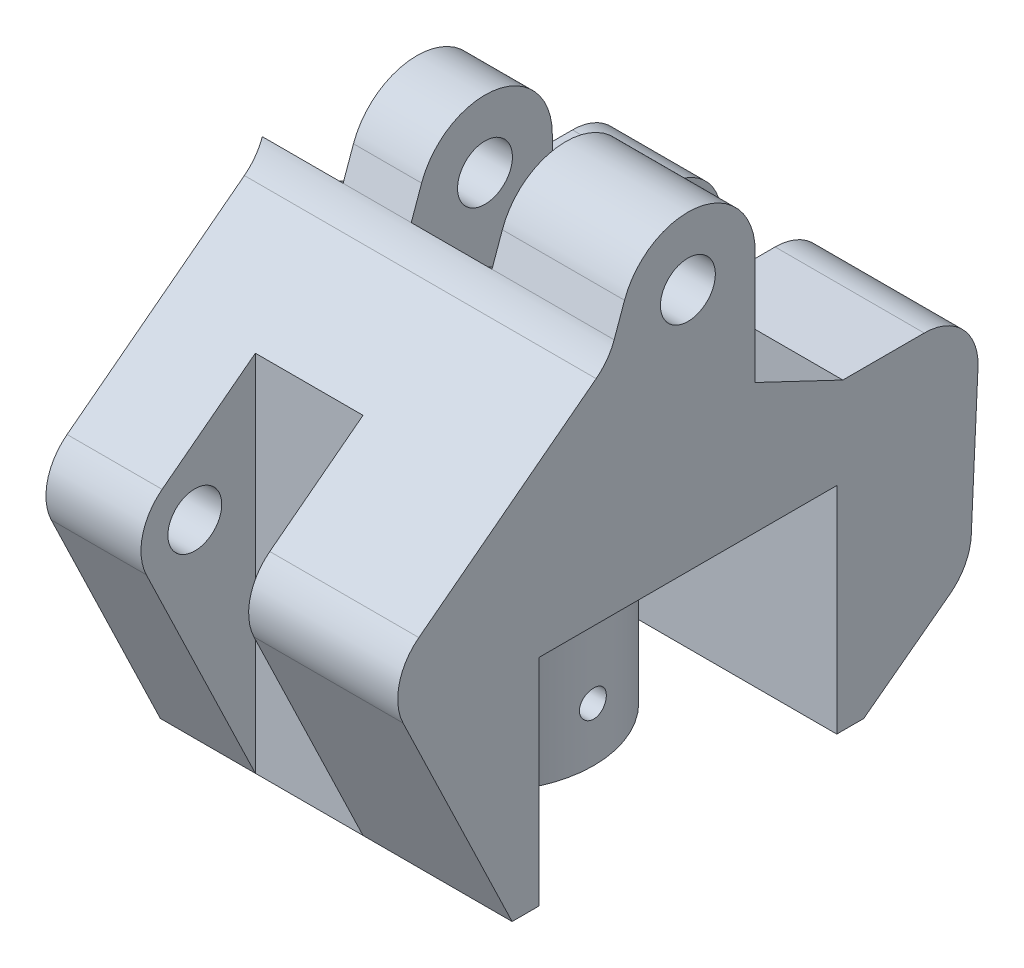
from build123d import *
from build123d.topology import SkipClean

# Parameters (mm, degrees)
SKETCH1_R                    = 3.2385
BOSS_EXTRUDE1_DEPTH          = 17.5641
CUT_EXTRUDE1_DEPTH           = 39.015523314
CUT_EXTRUDE1_DEPTH_BACK      = 39.015523314
SKETCH2_W                    = 9.525
SKETCH2_H                    = 33.5407
BOSS_EXTRUDE2_DEPTH          = 25.4
SKETCH17_R                   = 7.9375
CUT_EXTRUDE2_DEPTH           = 22.225
F_1_8_0_125_DIAMETER_HOLE1_D = 3.175
F_1_8_0_125_DIAMETER_HOLE3_D = 3.175
BOSS_EXTRUDE3_DEPTH          = 9.525
BOSS_EXTRUDE4_START          = -17.5641
BOSS_EXTRUDE4_DEPTH          = 9.525
BOSS_EXTRUDE5_REACH          = 68.916
SKETCH19_R                   = 3.175
CUT_EXTRUDE4_DEPTH           = 67.450455183
CUT_EXTRUDE4_DEPTH_BACK      = 67.450455183
SKETCH23_W                   = 12.7
SKETCH23_H                   = 13.97
SKETCH23_H_2                 = 13.49375
CUT_EXTRUDE3_DEPTH           = 74.083211618
SKETCH26_R                   = 3.2385
BOSS_EXTRUDE6_DEPTH          = 6.3754


with BuildPart() as part:
    # Sketch1 → Boss-Extrude1 (new, symmetric)
    with BuildSketch(Plane(origin=(0, 0, 0), x_dir=(0, 0, -1), z_dir=(1, 0, 0))):
        with BuildLine():
            ThreePointArc((7.475782216, 2.667693107), (0, 7.9375), (-7.475782216, 2.667693107))
            Line((-7.475782216, 2.667693107), (-17.5641, -25.6032))
            Line((-17.5641, -25.6032), (-17.5641, -28.7782))
            Line((-17.5641, -28.7782), (17.5641, -28.7782))
            Line((17.5641, -28.7782), (17.5641, -25.6032))
            Line((17.5641, -25.6032), (7.475782216, 2.667693107))
        make_face()
        Circle(SKETCH1_R, mode=Mode.SUBTRACT)
    extrude(amount=BOSS_EXTRUDE1_DEPTH, both=True)

    # Sketch2 → Cut-Extrude1 (cut, two sides: drawn at the far end of the back side and taken through both)
    with BuildSketch(Plane.XY.offset(-CUT_EXTRUDE1_DEPTH_BACK)):
        with Locations((4.7625, -8.83285)):
            Rectangle(SKETCH2_W, SKETCH2_H)
        with Locations((-12.8016, -8.83285)):
            Rectangle(SKETCH2_W, SKETCH2_H)
    extrude(amount=CUT_EXTRUDE1_DEPTH + CUT_EXTRUDE1_DEPTH_BACK, mode=Mode.SUBTRACT)

    # Sketch3 → Boss-Extrude2 (add)
    with BuildSketch(Plane.XZ.offset(28.7782)):
        with BuildLine():
            Line((0, -12.827), (-12.827, -12.827))
            Line((-12.827, -12.827), (-12.827, 12.827))
            Line((-12.827, 12.827), (0, 12.827))
            ThreePointArc((0, 12.827), (12.827, 0), (0, -12.827))
        make_face()
    extrude(amount=BOSS_EXTRUDE2_DEPTH)

    # Sketch17 → Cut-Extrude2 (cut)
    with BuildSketch(Plane.XZ.offset(54.1782)):
        with Locations(Location((0, 0, 0), (0, 0, 270))):
            Circle(SKETCH17_R)
    extrude(amount=-CUT_EXTRUDE2_DEPTH, mode=Mode.SUBTRACT)

    # 1/8 (0.125) Diameter Hole1 (through all)
    with Locations(Plane(origin=(-12.827, 0, 0), x_dir=(0, 0, -1), z_dir=(-1, 0, 0))):
        with Locations((0, 35.1282), (0, 47.8282)):
            Hole(F_1_8_0_125_DIAMETER_HOLE1_D / 2)

    # 1/8 (0.125) Diameter Hole3 (through all)
    with Locations(Plane(origin=(0, 0, -12.827), x_dir=(-1, 0, 0), z_dir=(0, 0, -1))):
        with Locations((0, -38.3032), (0, -44.6532)):
            Hole(F_1_8_0_125_DIAMETER_HOLE3_D / 2)

    # Sketch18 → Boss-Extrude3 (add)
    with BuildSketch(Plane.ZY.offset(8.0391)):
        with BuildLine():
            Line((-14.304105108, -16.467586998), (3.748678977, -7.885564818))
            ThreePointArc((3.748678977, -7.885564818), (7.171589481, -4.980264137), (8.698272775, -0.758140681))
            Line((8.698272775, -0.758140681), (17.5641, -25.6032))
            Line((17.5641, -25.6032), (-17.5641, -25.6032))
            Line((-17.5641, -25.6032), (-14.304105108, -16.467586998))
        make_face()
    extrude(amount=BOSS_EXTRUDE3_DEPTH)

    # Sketch18<2> → Boss-Extrude4 (add)
    with BuildSketch(Plane.ZY.offset(8.0391).offset(BOSS_EXTRUDE4_START)):
        with BuildLine():
            Line((-14.304105108, -16.467586998), (3.748678977, -7.885564818))
            ThreePointArc((3.748678977, -7.885564818), (7.171589481, -4.980264137), (8.698272775, -0.758140681))
            Line((8.698272775, -0.758140681), (17.5641, -25.6032))
            Line((17.5641, -25.6032), (-17.5641, -25.6032))
            Line((-17.5641, -25.6032), (-14.304105108, -16.467586998))
        make_face()
    extrude(amount=BOSS_EXTRUDE4_DEPTH)

    # Boss-Extrude5: up to this face of the body (flat: up to its plane)
    boss_extrude5_end = Plane(part.part.faces().sort_by_distance((17.5641, -14.475405556, 0))[0])
    # Sketch19 → Boss-Extrude5 (add, up to the picked face)
    with BuildSketch(Plane.ZY.offset(17.5641), mode=Mode.PRIVATE) as boss_extrude5_sk1:
        with BuildLine():
            Line((17.5641, -25.6032), (17.5641, -28.7782))
            Line((17.5641, -28.7782), (17.5641, -54.1782))
            Line((17.5641, -54.1782), (20.7391, -54.1782))
            Line((20.7391, -54.1782), (33.604040342, -27.46293277))
            ThreePointArc((33.604040342, -27.46293277), (34.058910171, -23.231780637), (31.740001069, -19.663557619))
            Line((31.740001069, -19.663557619), (10.821747478, -3.668278576))
            ThreePointArc((10.821747478, -3.668278576), (9.549308999, -2.36695441), (8.698272775, -0.758140681))
            Line((8.698272775, -0.758140681), (17.5641, -25.6032))
        make_face()
        with Locations((27.88285, -24.70785)):
            Circle(SKETCH19_R, mode=Mode.SUBTRACT)
    boss_extrude5_tool1 = split(extrude(boss_extrude5_sk1.sketch, amount=-BOSS_EXTRUDE5_REACH, mode=Mode.PRIVATE), bisect_by=boss_extrude5_end, keep=Keep.BOTH, mode=Mode.PRIVATE)
    # Sketch19 → Boss-Extrude5 (add, up to the picked face)
    with BuildSketch(Plane.ZY.offset(17.5641), mode=Mode.PRIVATE) as boss_extrude5_sk2:
        with BuildLine():
            Line((-17.5641, -54.1782), (-17.5641, -28.7782))
            Line((-17.5641, -28.7782), (-17.5641, -25.6032))
            Line((-17.5641, -25.6032), (-14.304105108, -16.467586998))
            Line((-14.304105108, -16.467586998), (-18.280383556, -18.35785))
            Line((-18.280383556, -18.35785), (-27.88285, -18.35785))
            ThreePointArc((-27.88285, -18.35785), (-32.477893649, -20.325148338), (-34.225749351, -25.008062957))
            Line((-34.225749351, -25.008062957), (-33.431999351, -41.778412957))
            ThreePointArc((-33.431999351, -41.778412957), (-32.699976255, -44.451509208), (-30.8991, -46.5582))
            Line((-30.8991, -46.5582), (-20.7391, -54.1782))
            Line((-20.7391, -54.1782), (-17.5641, -54.1782))
        make_face()
        with Locations((-27.0891, -41.4782)):
            Circle(SKETCH19_R, mode=Mode.SUBTRACT)
        with Locations((-27.88285, -24.70785)):
            Circle(SKETCH19_R, mode=Mode.SUBTRACT)
    boss_extrude5_tool2 = split(extrude(boss_extrude5_sk2.sketch, amount=-BOSS_EXTRUDE5_REACH, mode=Mode.PRIVATE), bisect_by=boss_extrude5_end, keep=Keep.BOTH, mode=Mode.PRIVATE)
    add(boss_extrude5_tool1.solids().sort_by(Axis((-17.5641, -28.142301, 22.142189), (1, 0, 0)))[0])
    add(boss_extrude5_tool2.solids().sort_by(Axis((-17.5641, -34.358051, -24.545625), (1, 0, 0)))[0])

    # Sketch23 → Cut-Extrude4 (cut, two sides: drawn at the far end of the back side and taken through both)
    with BuildSketch(Plane(origin=(0, 0, 0), x_dir=(1, 0, 0), z_dir=(0, 1, 0)).offset(-CUT_EXTRUDE4_DEPTH_BACK)):
        with Locations((0, 27.7241)):
            Rectangle(SKETCH23_W, SKETCH23_H)
        with Locations((0, -27.485975)):
            Rectangle(SKETCH23_W, SKETCH23_H_2)
    extrude(amount=CUT_EXTRUDE4_DEPTH + CUT_EXTRUDE4_DEPTH_BACK, mode=Mode.SUBTRACT)

    # Sketch22 → Cut-Extrude3 (cut, through all)
    with BuildSketch(Plane.ZY.offset(17.5641)):
        with BuildLine():
            Line((-7.9375, 0), (-7.9375, -13.440998634))
            Line((-7.9375, -13.440998634), (-14.304105108, -16.467586998))
            Line((-14.304105108, -16.467586998), (-7.475782216, 2.667693107))
            ThreePointArc((-7.475782216, 2.667693107), (-7.821218818, 1.353677383), (-7.9375, 0))
        make_face()
    extrude(amount=-CUT_EXTRUDE3_DEPTH, mode=Mode.SUBTRACT)

    # Sketch26 → Boss-Extrude6 (add)
    with SkipClean():  # the faces are left unmerged after this step: merging them gives an invalid solid
        with BuildSketch(Plane(origin=(17.5641, 0, 0), x_dir=(0, 0, -1), z_dir=(1, 0, 0))):
            with BuildLine():
                Line((7.9375, -13.440998634), (7.9375, 0))
                ThreePointArc((7.9375, 0), (1.353677383, 7.821218818), (-7.475782216, 2.667693107))
                Line((-7.475782216, 2.667693107), (-8.698272775, -0.758140681))
                ThreePointArc((-8.698272775, -0.758140681), (-9.549308999, -2.36695441), (-10.821747478, -3.668278576))
                Line((-10.821747478, -3.668278576), (-31.740001069, -19.663557619))
                ThreePointArc((-31.740001069, -19.663557619), (-34.058910171, -23.231780637), (-33.604040342, -27.46293277))
                Line((-33.604040342, -27.46293277), (-20.7391, -54.1782))
                Line((-20.7391, -54.1782), (-17.5641, -54.1782))
                Line((-17.5641, -54.1782), (-17.5641, -28.7782))
                Line((-17.5641, -28.7782), (17.5641, -28.7782))
                Line((17.5641, -28.7782), (17.5641, -54.1782))
                Line((17.5641, -54.1782), (20.7391, -54.1782))
                Line((20.7391, -54.1782), (30.8991, -46.5582))
                ThreePointArc((30.8991, -46.5582), (32.699976255, -44.451509208), (33.431999351, -41.778412957))
                Line((33.431999351, -41.778412957), (34.225749351, -25.008062957))
                ThreePointArc((34.225749351, -25.008062957), (32.477893649, -20.325148338), (27.88285, -18.35785))
                Line((27.88285, -18.35785), (18.280383556, -18.35785))
                Line((18.280383556, -18.35785), (7.9375, -13.440998634))
            make_face()
            with Locations(Location((0, 0, 0), (0, 0, 90))):
                Circle(SKETCH26_R, mode=Mode.SUBTRACT)
        extrude(amount=BOSS_EXTRUDE6_DEPTH)


solid = part.part
